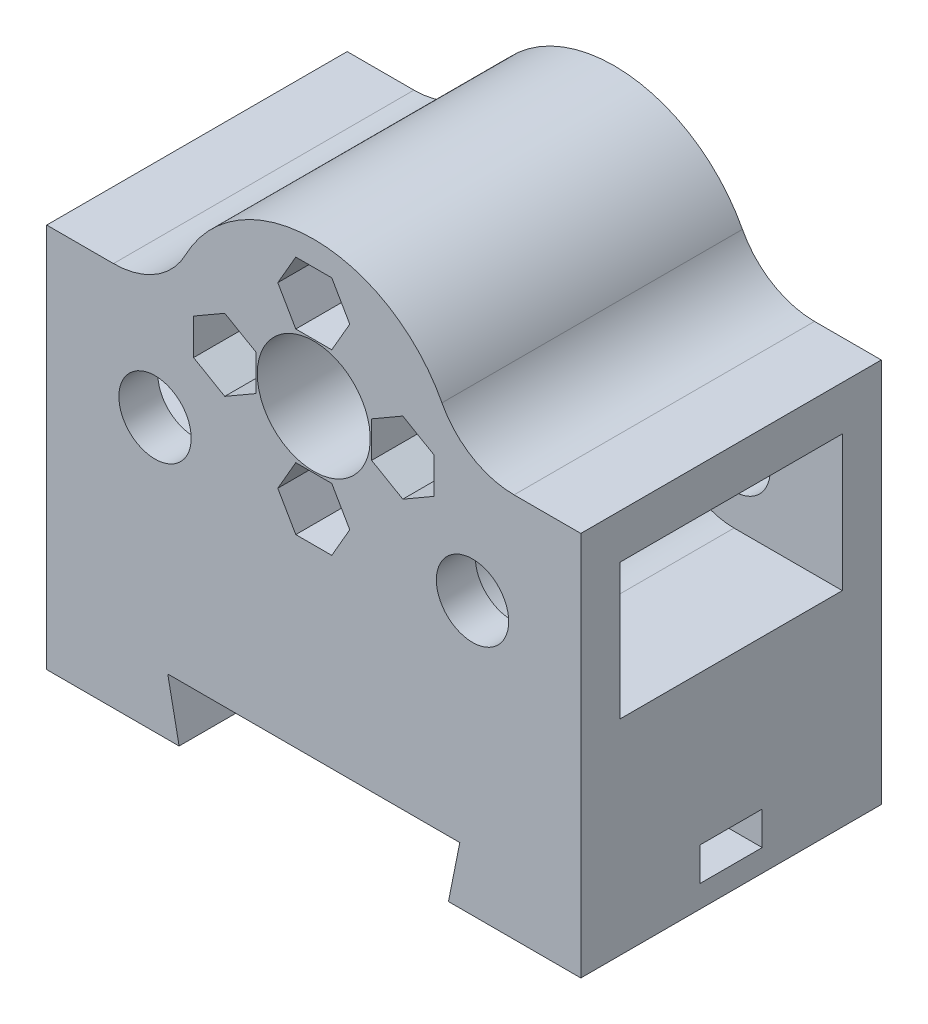
from build123d import *

# Parameters (mm, degrees)
SKETCH1_R                = 13
SKETCH1_W                = 48
SKETCH1_H                = 8
BOSS_EXTRUDE1_DEPTH      = 13.5
SKETCH2_R                = 11.15
CUT_EXTRUDE1_DEPTH       = 5
SKETCH2_3_R              = 5.075
CUT_EXTRUDE2_DEPTH       = 41.360872141
SKETCH3_R                = 6.1
CUT_EXTRUDE3_DEPTH       = 10
CUT_EXTRUDE4_DEPTH       = 41.360872141
SKETCH5_R                = 3.25
CUT_EXTRUDE5_DEPTH       = 33.897568299
M3_CLEARANCE_HOLE1_D     = 3.4
CUT_EXTRUDE6_DEPTH       = 5
CIRPATTERN1_COUNT        = 4
BOSS_EXTRUDE2_START      = -13.5
BOSS_EXTRUDE2_DEPTH      = 27
M3_CLEARANCE_HOLE2_D     = 3.4
M3_CLEARANCE_HOLE2_DEPTH = 12
M3_CLEARANCE_HOLE2_TIP   = 1.021463052
CUT_EXTRUDE7_START       = -5
SKETCH12_R               = 1.7
CUT_EXTRUDE7_DEPTH       = 3
CUT_EXTRUDE8_DEPTH       = 49.592694924


with BuildPart() as part:
    # Sketch1 → Boss-Extrude1 (new, symmetric)
    with BuildSketch(Plane.XY):
        with BuildLine():
            ThreePointArc((-8.306623863, 10), (-13, 0), (-8.306623863, -10))
            Line((-8.306623863, -10), (8.306623863, -10))
            ThreePointArc((8.306623863, -10), (11.768307232, -5.523309234), (13, 0))
            ThreePointArc((13, 0), (11.768307232, 5.523309234), (8.306623863, 10))
            Line((8.306623863, 10), (-8.306623863, 10))
        make_face()
        with BuildLine():
            ThreePointArc((8.306623863, 10), (0, 13), (-8.306623863, 10))
            Line((-8.306623863, 10), (8.306623863, 10))
        make_face()
        with BuildLine():
            ThreePointArc((13, 0), (11.768307232, -5.523309234), (8.306623863, -10))
            Line((8.306623863, -10), (24, -10))
            Line((24, -10), (24, 10))
            Line((24, 10), (8.306623863, 10))
            ThreePointArc((8.306623863, 10), (11.768307232, 5.523309234), (13, 0))
        make_face()
        with BuildLine():
            Line((8.306623863, -10), (-8.306623863, -10))
            ThreePointArc((-8.306623863, -10), (0, -13), (8.306623863, -10))
        make_face()
        with BuildLine():
            Line((-24, 10), (-24, -10))
            Line((-24, -10), (-8.306623863, -10))
            ThreePointArc((-8.306623863, -10), (-13, 0), (-8.306623863, 10))
            Line((-8.306623863, 10), (-24, 10))
        make_face()
        Circle(SKETCH1_R)
        with Locations((0, -14)):
            Rectangle(SKETCH1_W, SKETCH1_H)
    extrude(amount=BOSS_EXTRUDE1_DEPTH, both=True)

    # Sketch2 → Cut-Extrude1 (cut)
    with BuildSketch(Plane(origin=(0, 0, -13.5), x_dir=(-1, 0, 0), z_dir=(0, 0, -1))):
        Circle(SKETCH2_R)
    extrude(amount=-CUT_EXTRUDE1_DEPTH, mode=Mode.SUBTRACT)

    # Sketch2<3> → Cut-Extrude2 (cut, through all)
    with BuildSketch(Plane(origin=(0, 0, -13.5), x_dir=(-1, 0, 0), z_dir=(0, 0, -1))):
        Circle(SKETCH2_3_R)
    extrude(amount=-CUT_EXTRUDE2_DEPTH, mode=Mode.SUBTRACT)

    # Sketch3 → Cut-Extrude3 (cut, symmetric)
    with BuildSketch(Plane.XY):
        with Locations((-14.26606865, -8)):
            Circle(SKETCH3_R)
        with BuildLine():
            ThreePointArc((-14.26606865, -14.1), (-20.36606865, -8), (-14.26606865, -1.9))
            Line((-14.26606865, -1.9), (-24, -1.9))
            Line((-24, -1.9), (-24, -14.1))
            Line((-24, -14.1), (-14.26606865, -14.1))
        make_face()
    cut_extrude3 = extrude(amount=CUT_EXTRUDE3_DEPTH, both=True, mode=Mode.SUBTRACT)

    # Sketch4 → Cut-Extrude4 (cut, through all)
    with BuildSketch(Plane(origin=(0, 0, -13.5), x_dir=(-1, 0, 0), z_dir=(0, 0, -1))):
        with BuildLine():
            Line((18, 2.1), (24, 2.1))
            Line((24, 2.1), (24, 10))
            Line((24, 10), (8.306623863, 10))
            ThreePointArc((8.306623863, 10), (10.1107181, 8.171497996), (11.520065039, 6.023960615))
            ThreePointArc((11.520065039, 6.023960615), (14.212288818, 3.157449424), (18, 2.1))
        make_face()
    cut_extrude4 = extrude(amount=-CUT_EXTRUDE4_DEPTH, mode=Mode.SUBTRACT)

    # Sketch5 → Cut-Extrude5 (cut, symmetric)
    with BuildSketch(Plane.XY):
        with Locations((-14.26606865, -8)):
            Circle(SKETCH5_R)
    cut_extrude5 = extrude(amount=CUT_EXTRUDE5_DEPTH, both=True, mode=Mode.SUBTRACT)

    # Mirror1: Cut-Extrude3, Cut-Extrude4, Cut-Extrude5 across plane
    add(cut_extrude3.mirror(Plane(origin=(0, 0, 0), x_dir=(0, 0, 1), z_dir=(1, 0, 0))), mode=Mode.SUBTRACT)
    add(cut_extrude4.mirror(Plane(origin=(0, 0, 0), x_dir=(0, 0, 1), z_dir=(1, 0, 0))), mode=Mode.SUBTRACT)
    add(cut_extrude5.mirror(Plane(origin=(0, 0, 0), x_dir=(0, 0, 1), z_dir=(1, 0, 0))), mode=Mode.SUBTRACT)

    # M3 Clearance Hole1 (through all)
    with Locations(Plane(origin=(0, 0, -8.5), x_dir=(-1, 0, 0), z_dir=(0, 0, -1))):
        with Locations((0, -8), (-8, 0), (0, 8), (8, 0)):
            Hole(M3_CLEARANCE_HOLE1_D / 2)

    # Sketch8 → Cut-Extrude6 (cut)
    with BuildSketch(Plane.XY.offset(13.5)):
        Polygon((-10.8, -1.616580754), (-8, -3.233161507), (-5.2, -1.616580754), (-5.2, 1.616580754), (-8, 3.233161507), (-10.8, 1.616580754), align=None)
    cut_extrude6 = extrude(amount=-CUT_EXTRUDE6_DEPTH, mode=Mode.SUBTRACT)

    # CirPattern1: Cut-Extrude6 ×4 about axis
    cirpattern1_axis = Axis((0, 0, 0), (0, 0, 1))
    for i in range(1, CIRPATTERN1_COUNT):
        add(cut_extrude6.rotate(cirpattern1_axis, i * 360 / CIRPATTERN1_COUNT), mode=Mode.SUBTRACT)

    # Sketch9 → Boss-Extrude2 (add)
    with BuildSketch(Plane.XY.offset(BOSS_EXTRUDE2_START)):
        Polygon((12, -32.5), (24, -32.5), (24, -18), (-24, -18), (-24, -32.5), (-12, -32.5), (-13, -27.5), (13, -27.5), align=None)
    extrude(amount=BOSS_EXTRUDE2_DEPTH)

    # M3 Clearance Hole2
    with Locations(Plane(origin=(0, -32.5, 0), x_dir=(-1, 0, 0), z_dir=(0, -1, 0))):
        with Locations((-18.5, 0), (18.5, 0)):
            Hole(M3_CLEARANCE_HOLE2_D / 2, depth=M3_CLEARANCE_HOLE2_DEPTH)
            with Locations((0, 0, -(M3_CLEARANCE_HOLE2_DEPTH + M3_CLEARANCE_HOLE2_TIP / 2))):  # 118° drill point
                Cone(0, M3_CLEARANCE_HOLE2_D / 2, M3_CLEARANCE_HOLE2_TIP, mode=Mode.SUBTRACT)

    # Sketch12 → Cut-Extrude7 (cut)
    # profile 1 of 4: a face of its own
    with BuildSketch(Plane.XZ.offset(32.5).offset(CUT_EXTRUDE7_START)):
        Polygon((20.116580754, -2.8), (21.733161507, 0), (20.116580754, 2.8), (16.883419246, 2.8), (15.266838493, 0), (16.883419246, -2.8), align=None)
    # profile 2 of 4: a face of its own
    with BuildSketch(Plane.XZ.offset(32.5).offset(CUT_EXTRUDE7_START)):
        Polygon((24, -2.8), (20.116580754, -2.8), (21.733161507, 0), (20.116580754, 2.8), (24, 2.8), align=None)
    # profile 3 of 4: a face of its own
    with BuildSketch(Plane.XZ.offset(32.5).offset(CUT_EXTRUDE7_START)):
        Polygon((-15.266838493, 0), (-16.883419246, 2.8), (-20.116580754, 2.8), (-21.733161507, 0), (-20.116580754, -2.8), (-16.883419246, -2.8), align=None)
        with Locations(Location((-18.5, 0, 0), (0, 0, 270))):
            Circle(SKETCH12_R, mode=Mode.SUBTRACT)
    # profile 4 of 4: a face of its own
    with BuildSketch(Plane.XZ.offset(32.5).offset(CUT_EXTRUDE7_START)):
        Polygon((-21.733161507, 0), (-20.116580754, 2.8), (-24, 2.8), (-24, -2.8), (-20.116580754, -2.8), align=None)
    extrude(amount=CUT_EXTRUDE7_DEPTH, mode=Mode.SUBTRACT)

    # Sketch13 → Cut-Extrude8 (cut, through all)
    with BuildSketch(Plane.XY.offset(13.5)):
        Polygon((-12.098058068, -32.519611614), (12.098058068, -32.519611614), (13.12198039, -27.4), (-13.12198039, -27.4), align=None)
    extrude(amount=-CUT_EXTRUDE8_DEPTH, mode=Mode.SUBTRACT)


solid = part.part
